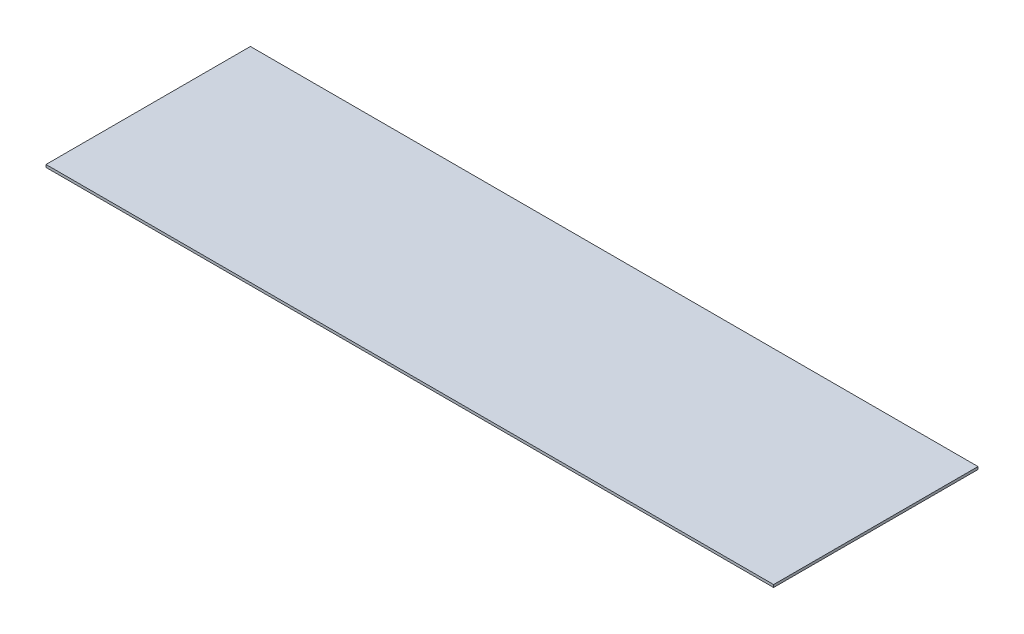
from build123d import *

# Parameters (mm, degrees)
SKETCH1_W           = 890
SKETCH1_H           = 250
BOSS_EXTRUDE1_DEPTH = 3.175


with BuildPart() as part:
    # Sketch1 → Boss-Extrude1 (new body)
    with BuildSketch(Plane(origin=(0, 0, 0), x_dir=(1, 0, 0), z_dir=(0, 1, 0))):
        with Locations((445, 125)):
            Rectangle(SKETCH1_W, SKETCH1_H)
    extrude(amount=BOSS_EXTRUDE1_DEPTH)


solid = part.part
